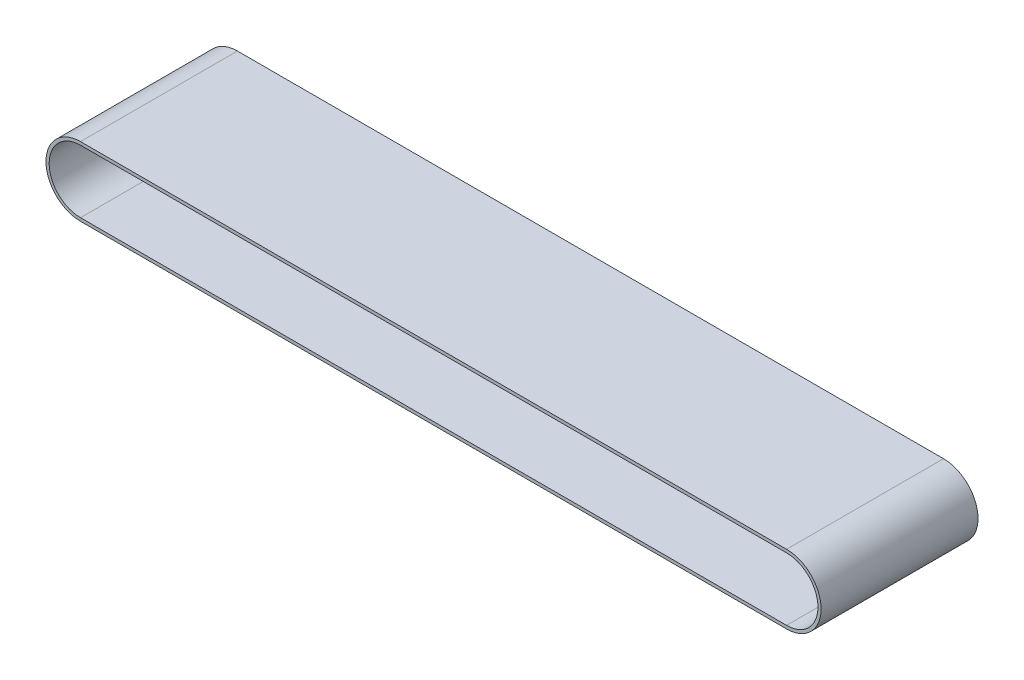
from build123d import *

# Parameters (mm, degrees)
BOSS_EXTRUDE1_DEPTH = 100
SHELL2_T            = -2


with BuildPart() as part:
    # Sketch1 → Boss-Extrude1 (new body)
    with BuildSketch(Plane.XY):
        with BuildLine():
            Line((-371.346770179, 20), (78.653229821, 20))
            ThreePointArc((78.653229821, 20), (100.653229821, -2), (78.653229821, -24))
            Line((78.653229821, -24), (-371.346770179, -24))
            ThreePointArc((-371.346770179, -24), (-393.346770179, -2), (-371.346770179, 20))
        make_face()
    extrude(amount=BOSS_EXTRUDE1_DEPTH)

    # Shell2
    shell2_openings = [part.faces().sort_by_distance(p)[0] for p in [
        (-146.346770179, -2, 100),
        (-146.346770179, -2, 0),
    ]]
    offset(amount=SHELL2_T, openings=shell2_openings, kind=Kind.INTERSECTION)


solid = part.part
